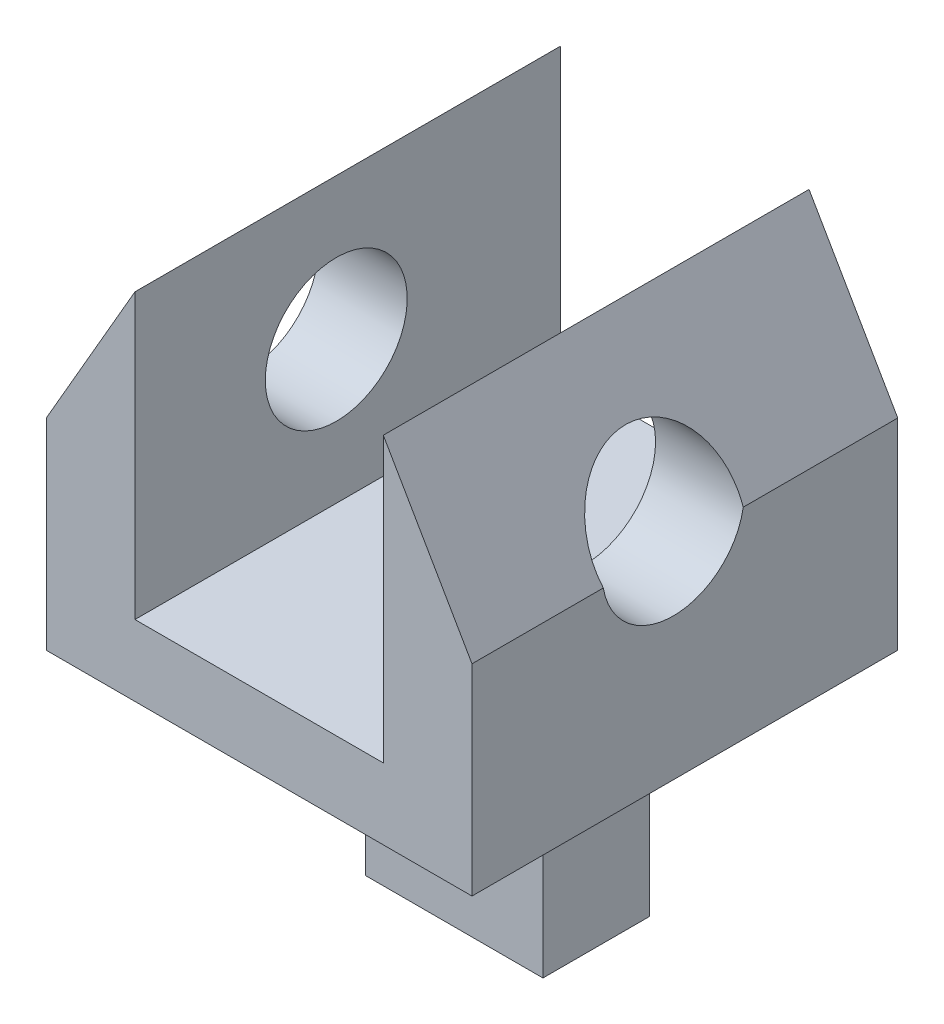
from build123d import *

# Parameters (mm, degrees)
SKETCH1_W                 = 12
SKETCH1_H                 = 12
BOSS_EXTRUDE1_DEPTH       = 2
SKETCH2_W                 = 2.5
SKETCH2_H                 = 12
BOSS_EXTRUDE2_DEPTH       = 8
CUT_EXTRUDE1_DEPTH        = 17.733200531
CUT_EXTRUDE2_DEPTH        = 16.041608956
CUT_EXTRUDE2_DEPTH_BACK   = 16.041608956
SKETCH4_R                 = 2
SKETCH6_W                 = 5
SKETCH6_H                 = 3
BOSS_EXTRUDE3_DEPTH       = 10
F_3_0MM_DOWEL_HOLE1_D     = 3
F_3_0MM_DOWEL_HOLE1_DEPTH = 3
F_3_0MM_DOWEL_HOLE1_TIP   = 0.901290929


with BuildPart() as part:
    # Sketch1 → Boss-Extrude1 (new body)
    with BuildSketch(Plane(origin=(0, 0, 0), x_dir=(1, 0, 0), z_dir=(0, 1, 0))):
        Rectangle(SKETCH1_W, SKETCH1_H)
    extrude(amount=BOSS_EXTRUDE1_DEPTH)

    # Sketch2 → Boss-Extrude2 (add)
    with BuildSketch(Plane(origin=(0, 2, 0), x_dir=(1, 0, 0), z_dir=(0, 1, 0))):
        with Locations((-4.75, 0)):
            Rectangle(SKETCH2_W, SKETCH2_H)
        with Locations((4.75, 0)):
            Rectangle(SKETCH2_W, SKETCH2_H)
    extrude(amount=BOSS_EXTRUDE2_DEPTH)

    # Sketch5 → Cut-Extrude1 (cut, through all)
    with BuildSketch(Plane.XY.offset(6)):
        Polygon((-3.5, 10), (-6, 5.669872981), (-6, 10), align=None)
        Polygon((3.5, 10), (6, 5.669872981), (6, 10), align=None)
    extrude(amount=-CUT_EXTRUDE1_DEPTH, mode=Mode.SUBTRACT)

    # Sketch4 → Cut-Extrude2 (cut, two sides: drawn at the far end of the back side and taken through both)
    with BuildSketch(Plane.ZY.offset(-3.5).offset(-CUT_EXTRUDE2_DEPTH_BACK)):
        with Locations((0.326138493, 6)):
            Circle(SKETCH4_R)
    extrude(amount=CUT_EXTRUDE2_DEPTH + CUT_EXTRUDE2_DEPTH_BACK, mode=Mode.SUBTRACT)

    # Sketch6 → Boss-Extrude3 (add)
    with BuildSketch(Plane.XZ):
        with Locations((-3.5, -4.5)):
            Rectangle(SKETCH6_W, SKETCH6_H)
    extrude(amount=BOSS_EXTRUDE3_DEPTH)

    # Ø3.0mm Dowel Hole1
    with Locations(Plane.XY.offset(-3)):
        with Locations((-3.5, -5)):
            Hole(F_3_0MM_DOWEL_HOLE1_D / 2, depth=F_3_0MM_DOWEL_HOLE1_DEPTH)
            with Locations((0, 0, -(F_3_0MM_DOWEL_HOLE1_DEPTH + F_3_0MM_DOWEL_HOLE1_TIP / 2))):  # 118° drill point
                Cone(0, F_3_0MM_DOWEL_HOLE1_D / 2, F_3_0MM_DOWEL_HOLE1_TIP, mode=Mode.SUBTRACT)


solid = part.part
